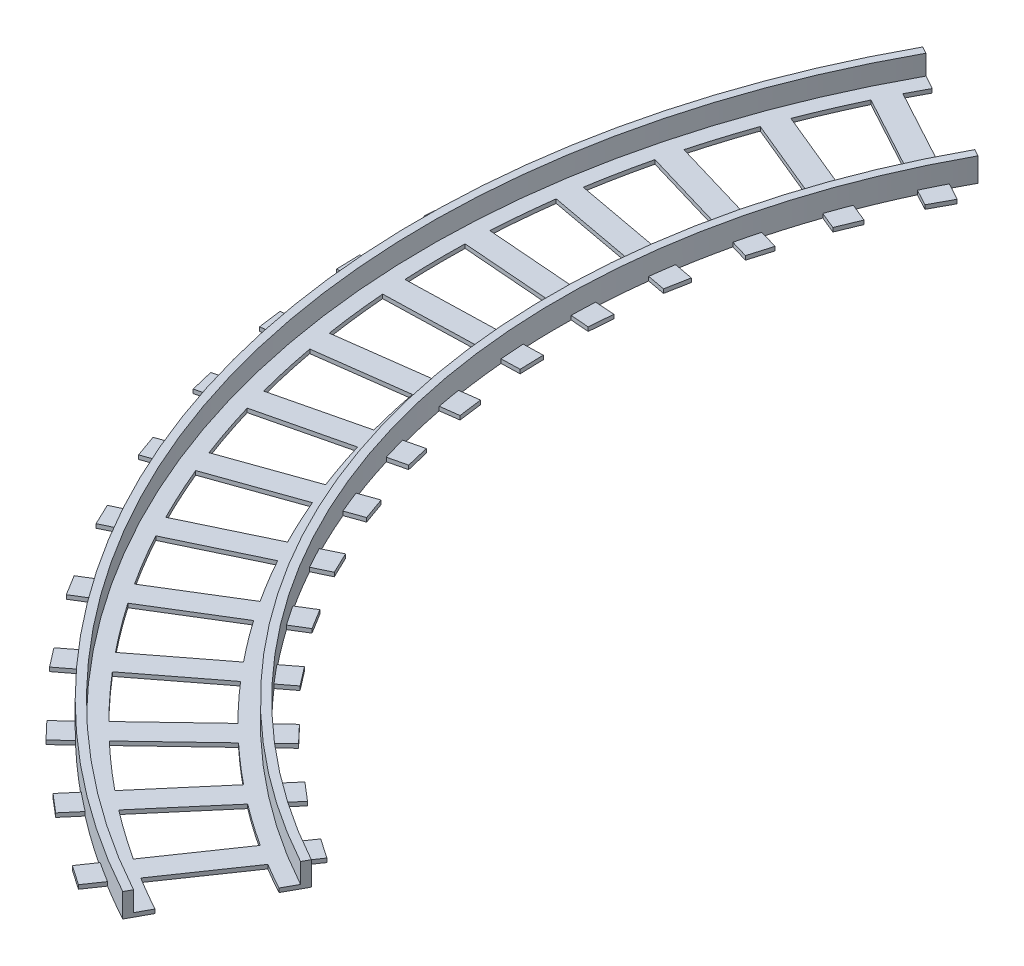
from build123d import *

# Parameters (mm, degrees)
BOSS_EXTRUDE1_DEPTH = 1


with BuildPart() as part:
    # Sweep1: sweep along a path in Sketch1
    with BuildLine(Plane(origin=(0, 0, 0), x_dir=(1, 0, 0), z_dir=(0, 1, 0))) as sweep1_path:
        ThreePointArc((-184.245414687, 100.765208117), (-201.532944095, -59.029420161), (-100.765208117, -184.245414687))
    # Sketch2 → Sweep1 (sweep)
    with BuildSketch(Plane(origin=(0, 0, 0), x_dir=(0.8773591175576726, 0, 0.47983432436458934), z_dir=(-0.47983432436458934, 0, 0.8773591175576726))):
        Polygon((-210, 0), (-210, 6), (-208, 6), (-208, 1), (-204, 1), (-204, 0), align=None)
        Polygon((-175, 0), (-175, 6), (-177, 6), (-177, 1), (-181, 1), (-181, 0), align=None)
    sweep(path=sweep1_path.line)

    # Sketch3 → Boss-Extrude1 (add)
    with BuildSketch(Plane(origin=(0, 0, 0), x_dir=(1, 0, 0), z_dir=(0, 1, 0))):
        Polygon((-200.480609031, 77.792493953), (-158.892377143, 60.6047376), (-161.18407799, 55.059640015), (-202.772309878, 72.247396368), align=None)
        Polygon((-191.250825431, 98.322268508), (-151.687027988, 76.881514514), (-154.545795187, 71.606341522), (-194.109592631, 93.047095516), align=None)
        Polygon((-117.774803715, -179.925657767), (-92.315961467, -142.819764011), (-87.368508966, -146.214276311), (-112.827351214, -183.320170066), align=None)
        Polygon((-135.936973526, -166.629186943), (-106.738975427, -132.387736813), (-102.173448743, -136.280803226), (-131.371446842, -170.522253357), align=None)
        Polygon((-152.609789408, -151.507091879), (-119.992534836, -120.505241867), (-115.858954834, -124.854209143), (-148.476209407, -155.856059155), align=None)
        Polygon((-167.610580502, -134.725053411), (-131.931430923, -107.302466273), (-128.275085971, -112.059686217), (-163.954235551, -139.482273355), align=None)
        Polygon((-180.774995001, -116.466939064), (-142.424858645, -92.924062405), (-139.285808423, -98.037413919), (-177.63594478, -121.580290578), align=None)
        Polygon((-191.958800826, -96.932788561), (-151.357849811, -77.527563063), (-148.770486411, -82.941023198), (-189.371437426, -102.346248697), align=None)
        Polygon((-201.039465859, -76.336622142), (-158.6325327, -61.281655516), (-156.625203817, -66.935913271), (-199.032136975, -81.990879897), align=None)
        Polygon((-207.917500433, -54.904095716), (-164.169204366, -44.364333328), (-162.763902714, -50.19743947), (-206.512198781, -60.737201859), align=None)
        Polygon((-212.517547363, -32.870028529), (-167.907203874, -26.96094622), (-167.119326232, -32.908992018), (-211.729669722, -38.818074327), align=None)
        Polygon((-214.789207572, -10.47583043), (-169.805576919, -9.262169343), (-169.643755441, -15.259986763), (-214.627386094, -16.47364785), align=None)
        Polygon((-214.707592276, 12.033143059), (-169.84352453, 8.538085799), (-170.309532164, 2.5562101), (-215.173599911, 6.05126736), align=None)
        Polygon((-212.273595668, 34.410278915), (-168.020630943, 26.244795887), (-169.109362014, 20.344400591), (-213.362326738, 28.509883618), align=None)
        Polygon((-207.513885125, 56.410408554), (-164.356868164, 43.663962499), (-166.056394305, 37.909693571), (-209.213411265, 50.656139626), align=None)
    extrude(amount=BOSS_EXTRUDE1_DEPTH)


solid = part.part
